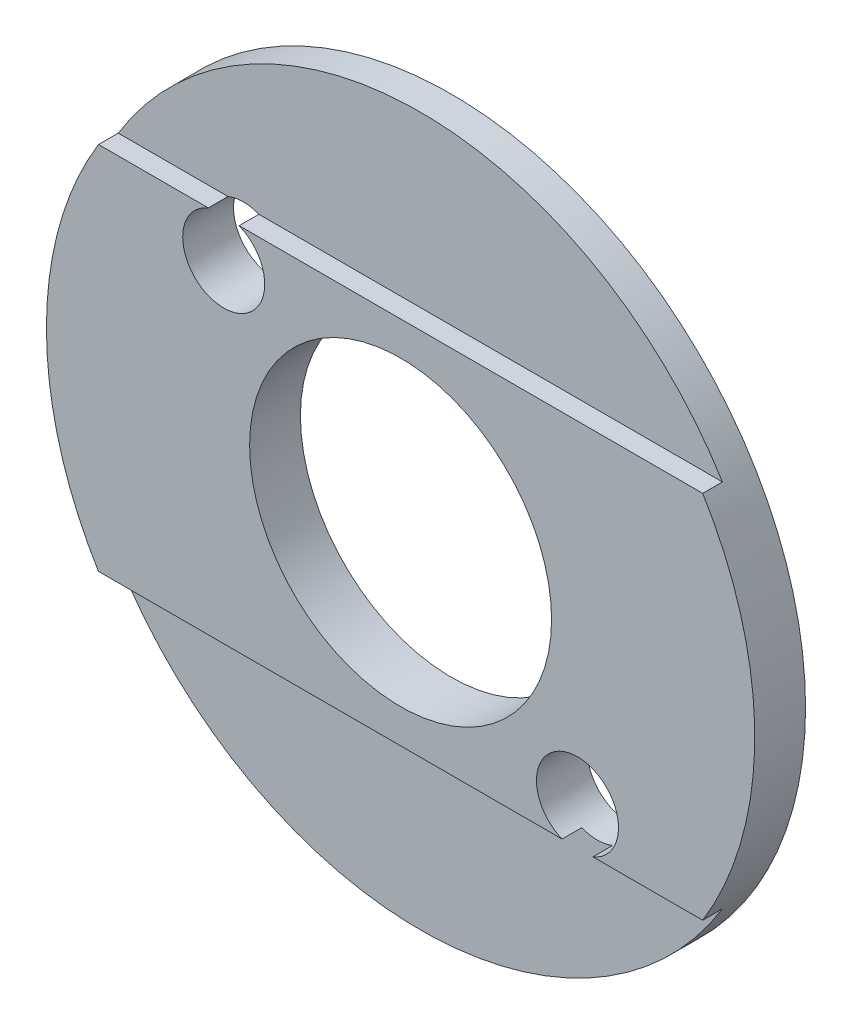
from build123d import *

# Parameters (mm, degrees)
SKETCH1_R           = 12.15
BOSS_EXTRUDE1_DEPTH = 1.5875
BOSS_EXTRUDE2_START = 2.5
SKETCH2_R           = 28.5
SKETCH2_R_2         = 3.3
SKETCH2_R_3         = 12.15
BOSS_EXTRUDE2_DEPTH = 2.5


with BuildPart() as part:
    # Sketch1 → Boss-Extrude1 (new body)
    with BuildSketch(Plane.XY):
        with BuildLine():
            ThreePointArc((-51.018397576, -63.258596209), (-55.208227379, -78.133596209), (-51.018397576, -93.008596209))
            Line((-51.018397576, -93.008596209), (-13.715257622, -93.008596209))
            ThreePointArc((-13.715257622, -93.008596209), (-14.317560686, -87.2135538), (-9.17433561, -89.950800833))
            ThreePointArc((-9.17433561, -89.950800833), (-9.737088578, -91.794025909), (-11.233413599, -93.008596209))
            Line((-11.233413599, -93.008596209), (-2.398057182, -93.008596209))
            ThreePointArc((-2.398057182, -93.008596209), (0.724324914, -85.860502103), (1.791772621, -78.133596209))
            ThreePointArc((1.791772621, -78.133596209), (0.724324914, -70.406690315), (-2.398057182, -63.258596209))
            Line((-2.398057182, -63.258596209), (-39.701197136, -63.258596209))
            ThreePointArc((-39.701197136, -63.258596209), (-38.204872114, -64.473166509), (-37.642119147, -66.316391585))
            ThreePointArc((-37.642119147, -66.316391585), (-42.785344223, -69.053638618), (-42.183041159, -63.258596209))
            Line((-42.183041159, -63.258596209), (-51.018397576, -63.258596209))
        make_face()
        with Locations((-26.708227379, -78.133596209)):
            Circle(SKETCH1_R, mode=Mode.SUBTRACT)
    extrude(amount=BOSS_EXTRUDE1_DEPTH)

    # Sketch2 → Boss-Extrude2 (add)
    with BuildSketch(Plane(origin=(0, 0, 0), x_dir=(-1, 0, 0), z_dir=(0, 0, -1)).offset(BOSS_EXTRUDE2_START)):
        with Locations((26.708227379, -78.133596209)):
            Circle(SKETCH2_R)
        with Locations((40.942119147, -66.316391585)):
            Circle(SKETCH2_R_2, mode=Mode.SUBTRACT)
        with Locations((12.47433561, -89.950800833)):
            Circle(SKETCH2_R_2, mode=Mode.SUBTRACT)
        with Locations((26.708227379, -78.133596209)):
            Circle(SKETCH2_R_3, mode=Mode.SUBTRACT)
    extrude(amount=-BOSS_EXTRUDE2_DEPTH)


solid = part.part
